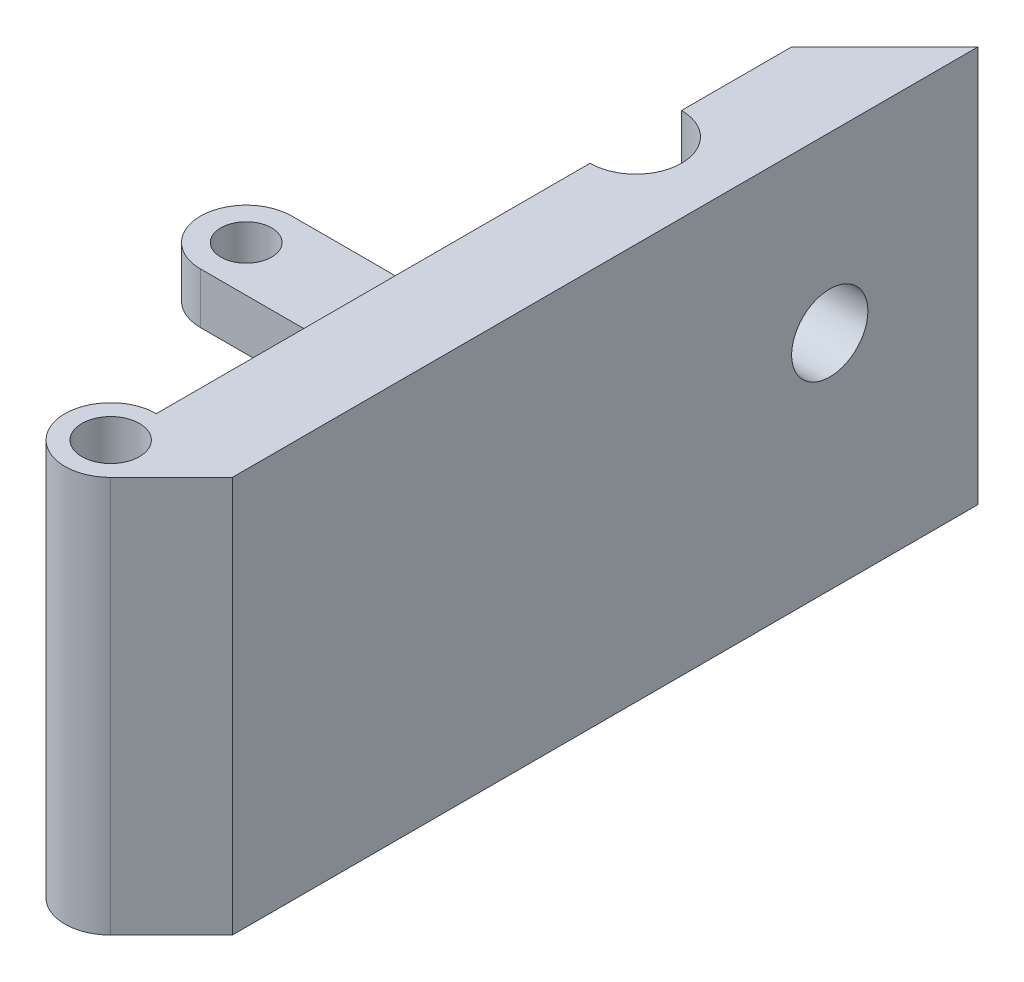
from build123d import *

# Parameters (mm, degrees)
SKETCH1_R           = 1.7
BOSS_EXTRUDE1_DEPTH = 11.7
SKETCH2_R           = 2.25
CUT_EXTRUDE1_DEPTH  = 101.718518655
BOSS_EXTRUDE2_START = -2
SKETCH3_R           = 1.5
BOSS_EXTRUDE2_DEPTH = 3
BOSS_EXTRUDE3_START = -19
SKETCH3_2_R         = 1.5
BOSS_EXTRUDE3_DEPTH = 3


with BuildPart() as part:
    # Sketch1 → Boss-Extrude1 (new, symmetric)
    with BuildSketch(Plane(origin=(0, 0, 0), x_dir=(1, 0, 0), z_dir=(0, 1, 0))):
        with BuildLine():
            Line((60, 94.2), (65.5, 99.7))
            Line((65.5, 99.7), (65.5, 55.681623382))
            Line((65.5, 55.681623382), (61.909188309, 52.090811691))
            ThreePointArc((61.909188309, 52.090811691), (57.505525262, 52.966754733), (60, 56.7))
            Line((60, 56.7), (60, 82.3))
            ThreePointArc((60, 82.3), (62.7, 85), (60, 87.7))
            Line((60, 87.7), (60, 88.7))
            Line((60, 88.7), (60, 93.2))
            Line((60, 93.2), (60, 94.2))
        make_face()
        with Locations((60, 54)):
            Circle(SKETCH1_R, mode=Mode.SUBTRACT)
    extrude(amount=BOSS_EXTRUDE1_DEPTH, both=True)

    # Sketch2 → Cut-Extrude1 (cut, through all)
    with BuildSketch(Plane(origin=(65.5, 0, 0), x_dir=(0, 0, -1), z_dir=(1, 0, 0))):
        with Locations((90.95, 1.45)):
            Circle(SKETCH2_R)
    extrude(amount=-CUT_EXTRUDE1_DEPTH, mode=Mode.SUBTRACT)

    # Sketch3 → Boss-Extrude2 (add)
    with BuildSketch(Plane.XZ.offset(11.7).offset(BOSS_EXTRUDE2_START)):
        with BuildLine():
            Line((52.5, -66.8), (60, -66.8))
            Line((60, -66.8), (60, -72.2))
            Line((60, -72.2), (52.5, -72.2))
            ThreePointArc((52.5, -72.2), (49.8, -69.5), (52.5, -66.8))
        make_face()
        with Locations((52.5, -69.5)):
            Circle(SKETCH3_R, mode=Mode.SUBTRACT)
    extrude(amount=-BOSS_EXTRUDE2_DEPTH)

    # Sketch3<2> → Boss-Extrude3 (add)
    with BuildSketch(Plane.XZ.offset(11.7).offset(BOSS_EXTRUDE3_START)):
        with BuildLine():
            Line((52.5, -66.8), (60, -66.8))
            Line((60, -66.8), (60, -72.2))
            Line((60, -72.2), (52.5, -72.2))
            ThreePointArc((52.5, -72.2), (49.8, -69.5), (52.5, -66.8))
        make_face()
        with Locations((52.5, -69.5)):
            Circle(SKETCH3_2_R, mode=Mode.SUBTRACT)
    extrude(amount=-BOSS_EXTRUDE3_DEPTH)


solid = part.part
